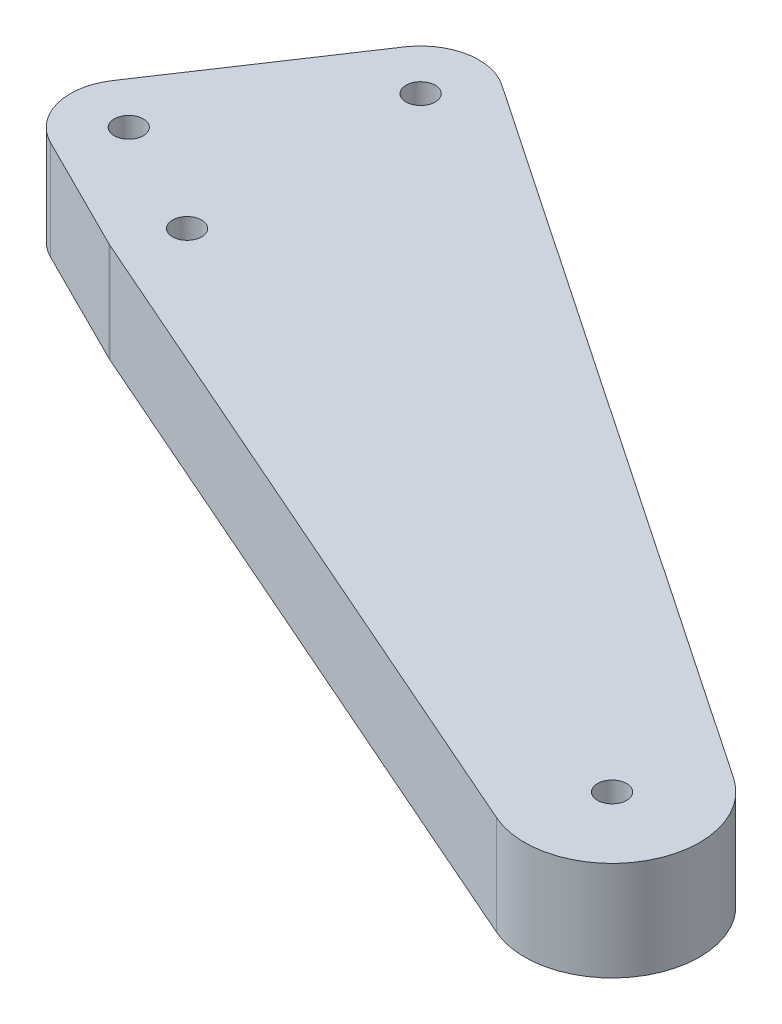
from build123d import *

# Parameters (mm, degrees)
BOSS_EXTRUDE1_DEPTH = 17
SKETCH2_R           = 2.5
CUT_EXTRUDE1_DEPTH  = 150.608956951


with BuildPart() as part:
    # Sketch1 → Boss-Extrude1 (new body)
    with BuildSketch(Plane(origin=(0, 0, 0), x_dir=(1, 0, 0), z_dir=(0, 1, 0))):
        with BuildLine():
            Line((5.602489683, 48.283242683), (128.403734525, -34.775135975))
            ThreePointArc((128.403734525, -34.775135975), (133.134081041, -54.445406491), (113.972324622, -60.935615368))
            Line((113.972324622, -60.935615368), (-4.018450252, -9.157076912))
            ThreePointArc((-4.018450252, -9.157076912), (-4.246626311, -9.053516719), (-4.472135955, -8.94427191))
            Line((-4.472135955, -8.94427191), (-24.472135955, 1.05572809))
            ThreePointArc((-24.472135955, 1.05572809), (-29.664996488, 7.433320648), (-28.320502943, 15.547001962))
            Line((-28.320502943, 15.547001962), (-8.320502943, 45.547001962))
            ThreePointArc((-8.320502943, 45.547001962), (-1.928380756, 49.81230593), (5.602489683, 48.283242683))
        make_face()
    extrude(amount=BOSS_EXTRUDE1_DEPTH)

    # Sketch2 → Cut-Extrude1 (cut, through all)
    with BuildSketch(Plane(origin=(0, 17, 0), x_dir=(1, 0, 0), z_dir=(0, 1, 0))):
        with Locations(Location((0, 40, 0), (0, 0, 270))):
            Circle(SKETCH2_R)
        with Locations(Location((0, 0, 0), (0, 0, 270))):
            Circle(SKETCH2_R)
        with Locations(Location((120, -47.2, 0), (0, 0, 270))):
            Circle(SKETCH2_R)
        with Locations(Location((-20, 10, 0), (0, 0, 270))):
            Circle(SKETCH2_R)
    extrude(amount=-CUT_EXTRUDE1_DEPTH, mode=Mode.SUBTRACT)


solid = part.part
